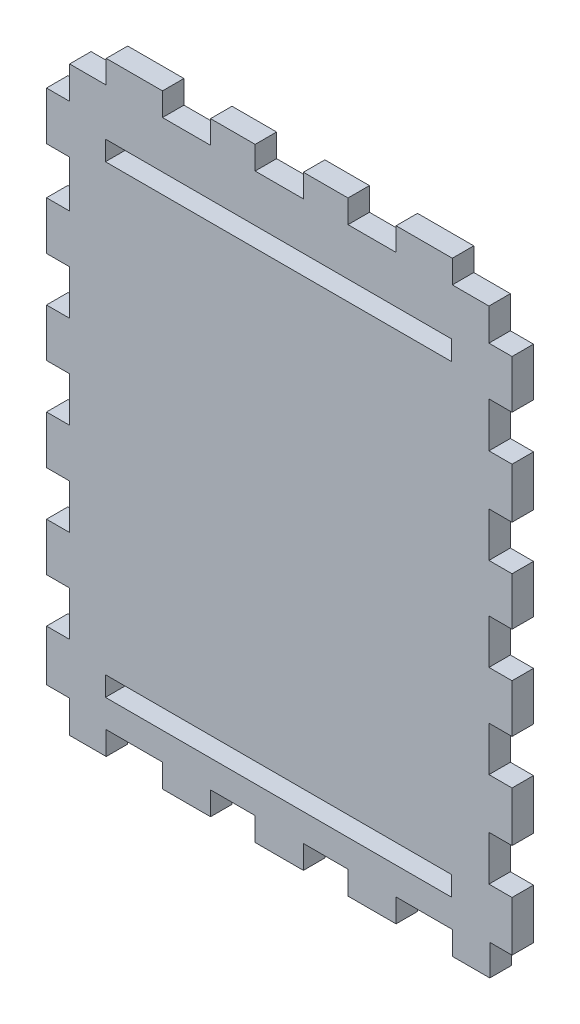
from build123d import *

# Parameters (mm, degrees)
MODEL_W             = 59.689998908
MODEL_H             = 3.386668819
MODEL_H_2           = 3.386666801
BOSS_EXTRUDE1_DEPTH = 3.7


with BuildPart() as part:
    # Model → Boss-Extrude1 (new body)
    with BuildSketch(Plane.XY):
        Polygon((171.653953395, 180.763341901), (167.667564776, 180.763341901), (167.667564776, 188.523500843), (171.653953393, 188.523500843), (171.653953393, 196.849055858), (167.667564774, 196.849055858), (167.667564774, 202.396336528), (161.352865562, 202.396336528), (161.352865562, 206.382725147), (151.651476676, 206.382725147), (151.651476676, 202.396336528), (143.3611989, 202.396336528), (143.3611989, 206.382725147), (135.670644961, 206.382725147), (135.670644961, 202.396336528), (127.3450886, 202.396336528), (127.3450886, 206.382725147), (119.654533316, 206.382725147), (119.654533316, 202.396336528), (111.36425554, 202.396336528), (111.36425554, 206.382725147), (101.662866654, 206.382725147), (101.662866654, 202.396336528), (95.348117657, 202.396336528), (95.348117657, 196.809013257), (91.361729039, 196.809013257), (91.361729039, 188.483458242), (95.348117657, 188.483458848), (95.348117657, 180.418280574), (91.361733076, 180.418280574), (91.361733076, 172.092725559), (95.348117657, 172.092725559), (95.348117657, 164.402168929), (91.361733076, 164.402168929), (91.361733076, 156.111891153), (95.348117657, 156.111891153), (95.348117657, 148.421337214), (91.361733076, 148.421337214), (91.361733076, 140.095782199), (95.348117657, 140.095782199), (95.348117657, 132.405225569), (91.361733076, 132.405225569), (91.361733076, 124.114947793), (95.348117574, 124.114947793), (95.348117574, 116.440193769), (91.361728955, 116.440193769), (91.361728955, 107.667091645), (95.348117574, 107.667091645), (95.348117658, 102.101616643), (101.662843109, 102.101616643), (101.662843109, 106.123281156), (111.364231995, 106.123281156), (111.364231995, 102.101616643), (119.654509771, 102.101616643), (119.654509771, 106.123281156), (127.34506371, 106.123281156), (127.34506371, 102.101616643), (135.67062007, 102.101616643), (135.67062007, 106.123281156), (143.361175355, 106.123281156), (143.361175355, 102.101616643), (151.651453131, 102.101616643), (151.651453131, 106.123281156), (161.352842017, 106.123281156), (161.352842017, 102.101616643), (167.820439872, 102.103733493), (167.820439872, 107.429661364), (171.653953395, 107.429661364), (171.653953395, 116.049769541), (167.667564776, 116.049769541), (167.667564776, 123.789730804), (171.653953395, 123.789730804), (171.653953395, 132.405225594), (167.667564776, 132.405225594), (167.667564776, 136.4004416), (167.667564776, 140.095782224), (171.653953395, 140.095782224), (171.653953395, 148.421337239), (167.667564776, 148.421337239), (167.667564776, 153.3044818), (167.667564776, 156.111891178), (171.653953395, 156.111891178), (171.653953395, 164.402168953), (167.667564776, 164.402168953), (167.667564776, 172.092725584), (171.653953395, 172.092725584), align=None)
        with Locations((131.366728222, 112.565500146)):
            Rectangle(MODEL_W, MODEL_H, mode=Mode.SUBTRACT)
        with Locations((131.366728222, 192.567447735)):
            Rectangle(MODEL_W, MODEL_H_2, mode=Mode.SUBTRACT)
    extrude(amount=BOSS_EXTRUDE1_DEPTH)


solid = part.part
